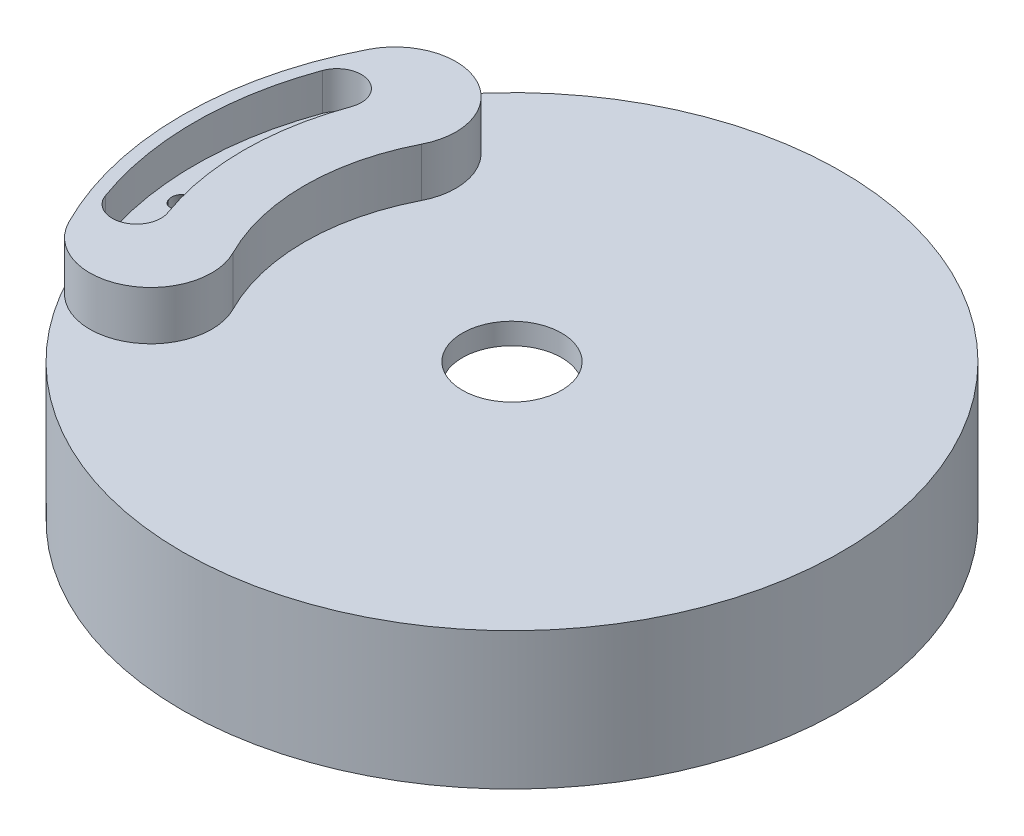
from build123d import *

# Parameters (mm, degrees)
GEAR_START                      = -10
SKETCH1_R                       = 10.16
GEAR_SLOT_DEPTH                 = 10
CIRPATTERN1_COUNT               = 2
CIRPATTERN1_ANGLE               = 10
CIRPATTERN1_THE_OTHER_WAY_COUNT = 2
CIRPATTERN1_THE_OTHER_WAY_ANGLE = 10
GAS_MANIFOLD_DEPTH              = 7.62


with BuildPart() as part:
    # Sketch9 → Revolve1 (revolve)
    with BuildSketch(Plane.XY, mode=Mode.PRIVATE) as revolve1_sk:
        Polygon((-10.16, 10.16), (-10.16, 24.525), (-67.5, 24.525), (-67.5, -13.575), (-63.375, -13.575), (-63.375, 10.795), (-53.825, 10.795), (-53.825, 5.08), (-46, 5.08), (-46, 6.35), (-36, 6.35), (-36, 7.62), (-21, 7.62), (-21, 10.16), align=None)
    revolve(revolve1_sk.sketch.rotate(Axis((0, 18.1216542, 0), (0, -1, 0)), 270), axis=Axis((0, 18.1216542, 0), (0, -1, 0)))

    # Sketch1 → Gear Slot (cut)
    with BuildSketch(Plane(origin=(0, 24.525, 0), x_dir=(1, 0, 0), z_dir=(0, 1, 0)).offset(GEAR_START)):
        with BuildLine():
            ThreePointArc((-60.123839141, -30.681818182), (15.778004595, -65.630058441), (67.5, 0))
            ThreePointArc((67.5, 0), (15.778004595, 65.630058441), (-60.123839141, 30.681818182))
            ThreePointArc((-60.123839141, 30.681818182), (-43.307976674, 36.134044285), (-37.85575057, 19.318181818))
            ThreePointArc((-37.85575057, 19.318181818), (-42.5, 0), (-37.85575057, -19.318181818))
            ThreePointArc((-37.85575057, -19.318181818), (-43.307976674, -36.134044285), (-60.123839141, -30.681818182))
        make_face()
        with Locations(Location((0, 0, 0), (0, 0, 270))):
            Circle(SKETCH1_R, mode=Mode.SUBTRACT)
    extrude(amount=GEAR_SLOT_DEPTH, mode=Mode.SUBTRACT)

    # Sketch5 one side → Orifice (revolve, cut)
    with BuildSketch(Plane(origin=(-60, 0, 0), x_dir=(0, 0, -1), z_dir=(1, 0, 0)), mode=Mode.PRIVATE) as orifice_sk:
        Polygon((-9.77813806, 16.364061196), (-7.26937996, 3.457619634), (-2.759272111, 5.65734621), (-10.553511101, 21.637904353), (-12.005063486, 20.929934951), align=None)
    orifice = revolve(orifice_sk.sketch.rotate(Axis((-60, 5.65734621, 2.759272111), (0, 0.8987940462991696, 0.43837114678907213)), 180), axis=Axis((-60, 5.65734621, 2.759272111), (0, 0.8987940462991696, 0.43837114678907213)), mode=Mode.SUBTRACT)

    # CirPattern1: Orifice ×2 about axis
    cirpattern1_axis = Axis((0, 17.78, 0), (0, -1, 0))
    for i in range(1, CIRPATTERN1_COUNT):
        add(orifice.rotate(cirpattern1_axis, i * CIRPATTERN1_ANGLE / (CIRPATTERN1_COUNT - 1)), mode=Mode.SUBTRACT)

    # CirPattern1 the other way: Orifice ×2 about axis
    cirpattern1_the_other_way_axis = Axis((0, 17.78, 0), (0, 1, 0))
    for i in range(1, CIRPATTERN1_THE_OTHER_WAY_COUNT):
        add(orifice.rotate(cirpattern1_the_other_way_axis, i * CIRPATTERN1_THE_OTHER_WAY_ANGLE / (CIRPATTERN1_THE_OTHER_WAY_COUNT - 1)), mode=Mode.SUBTRACT)

    # Sketch10 → Gas Manifold (cut)
    with BuildSketch(Plane(origin=(0, 24.525, 0), x_dir=(1, 0, 0), z_dir=(0, 1, 0))):
        with BuildLine():
            ThreePointArc((-51.683094143, -18.811107883), (-55, 0), (-51.683094143, 18.811107883))
            ThreePointArc((-51.683094143, 18.811107883), (-54.671456531, 25.219671703), (-61.080020351, 22.231309316))
            ThreePointArc((-61.080020351, 22.231309316), (-65, 0), (-61.080020351, -22.231309316))
            ThreePointArc((-61.080020351, -22.231309316), (-54.671456531, -25.219671703), (-51.683094143, -18.811107883))
        make_face()
    extrude(amount=-GAS_MANIFOLD_DEPTH, mode=Mode.SUBTRACT)


solid = part.part
